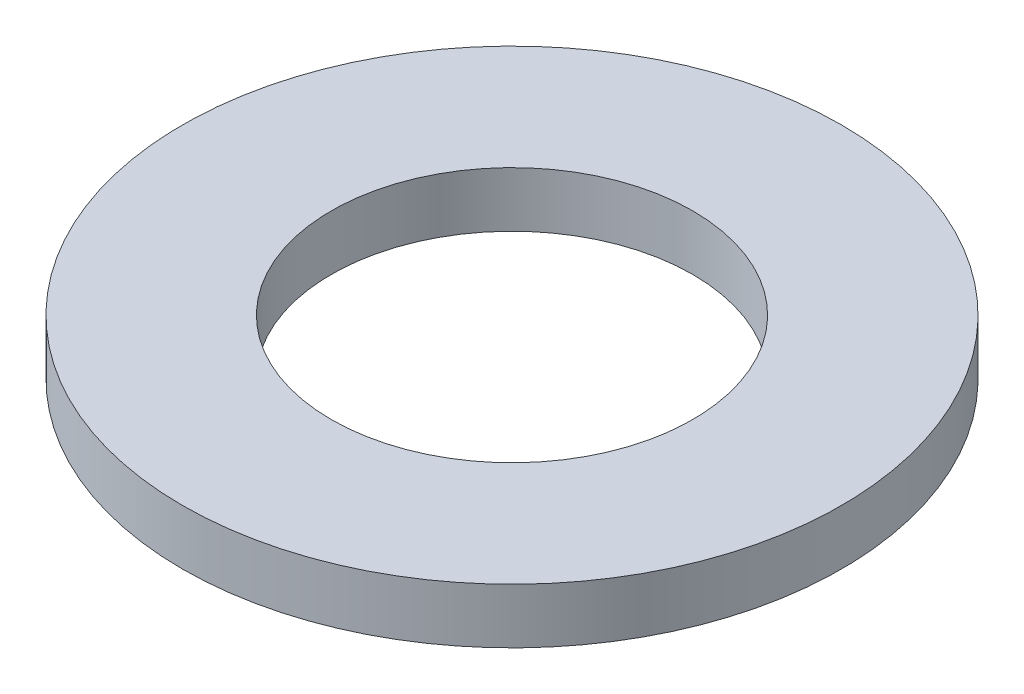
from build123d import *

# Parameters (mm, degrees)
SKETCH2_R           = 37.973
SKETCH2_R_2         = 20.828
BOSS_EXTRUDE1_DEPTH = 3.175


with BuildPart() as part:
    # Sketch2 → Boss-Extrude1 (new, symmetric)
    with BuildSketch(Plane(origin=(0, 0, 0), x_dir=(1, 0, 0), z_dir=(0, 1, 0))):
        with Locations(Location((0, 0, 0), (0, 0, 270))):
            Circle(SKETCH2_R)
        with Locations(Location((0, 0, 0), (0, 0, 270))):
            Circle(SKETCH2_R_2, mode=Mode.SUBTRACT)
    extrude(amount=BOSS_EXTRUDE1_DEPTH, both=True)


solid = part.part
